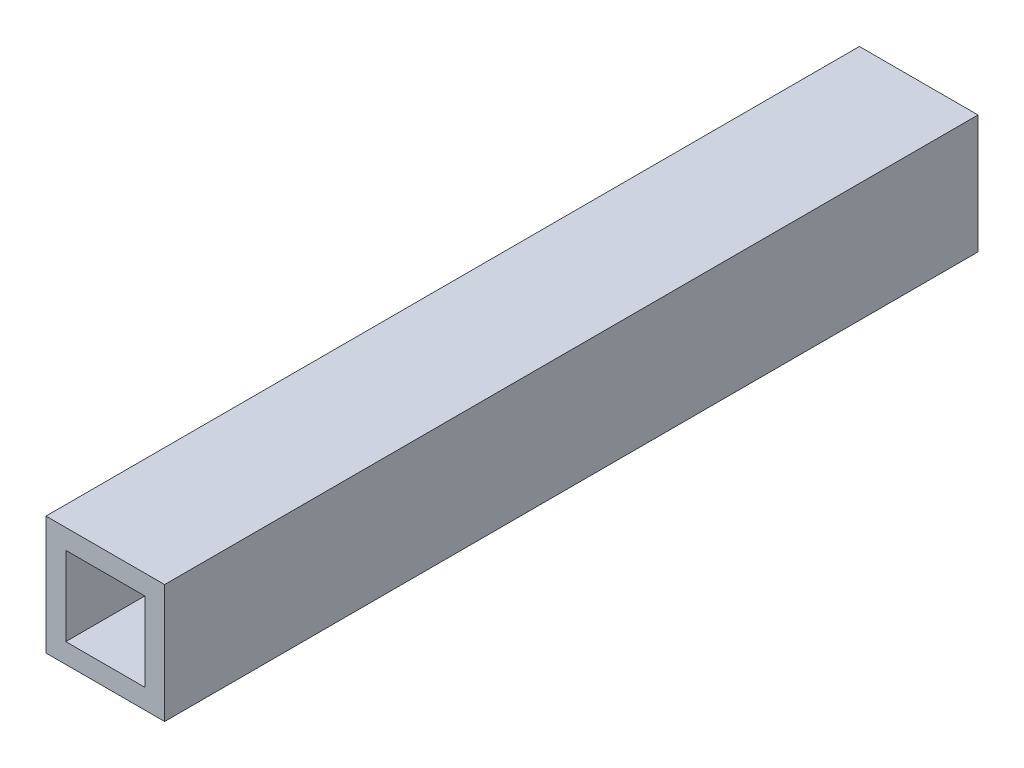
from build123d import *

# Parameters (mm, degrees)
SKETCH1_W           = 30
SKETCH1_H           = 30
SKETCH1_W_2         = 20
SKETCH1_H_2         = 20
BOSS_EXTRUDE1_DEPTH = 205.7


with BuildPart() as part:
    # Sketch1 → Boss-Extrude1 (new body)
    with BuildSketch(Plane.XY):
        Rectangle(SKETCH1_W, SKETCH1_H)
        Rectangle(SKETCH1_W_2, SKETCH1_H_2, mode=Mode.SUBTRACT)
    extrude(amount=BOSS_EXTRUDE1_DEPTH)


solid = part.part
